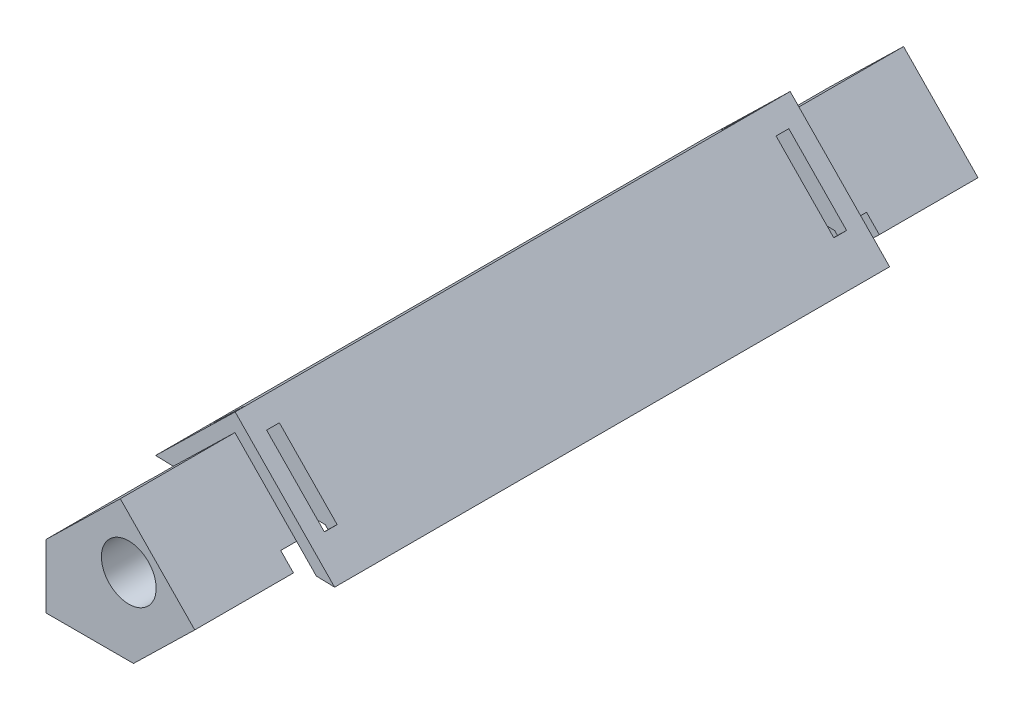
from build123d import *

# Parameters (mm, degrees)
BOSS_EXTRU_1_DEPTH       = 61.5
D_GAGEMENT_M41_D         = 4.3
D_GAGEMENT_M41_DEPTH     = 6
D_GAGEMENT_M41_TIP       = 1.291850331
D_GAGEMENT_M42_D         = 4.3
D_GAGEMENT_M42_DEPTH     = 6
D_GAGEMENT_M42_TIP       = 1.291850331
ESQUISSE9_W              = 1
ESQUISSE9_H              = 6.5
ENL_V_MAT_EXTRU_2_DEPTH  = 66.352343655
ESQUISSE11_W             = 3
ESQUISSE11_H             = 1
ENL_V_MAT_EXTRU_3_DEPTH  = 1
ENL_V_MAT_EXTRU_4_DEPTH  = 23
ENL_V_MAT_EXTRU_7_DEPTH  = 23
ESQUISSE16_W             = 8.145455673
ESQUISSE16_H             = 43.5
ESQUISSE16_W_2           = 3
ESQUISSE16_H_2           = 1
BOSS_EXTRU_2_DEPTH       = 1
ESQUISSE17_W             = 43.576204057
ESQUISSE17_H             = 9.375689411
ESQUISSE17_W_2           = 1
ESQUISSE17_H_2           = 6.5
BOSS_EXTRU_3_DEPTH       = 1
ESQUISSE18_W             = 16.892190225
ESQUISSE18_H             = 46
ENL_V_MAT_EXTRU_8_DEPTH  = 1
BOSS_EXTRU_4_START       = -43.576204
BOSS_EXTRU_4_DEPTH       = 43.576204
ESQUISSE23_W             = 1
ESQUISSE23_H             = 6.5
ENL_V_MAT_EXTRU_11_DEPTH = 66.811115965


with BuildPart() as part:
    # Esquisse1 → Boss.-Extru.1 (new body)
    with BuildSketch(Plane.XY):
        Polygon((-29.2538383, -8.878195219), (-29.2538383, -3.878764136), (-23.419589724, 1.805423729), (-17.574736592, -4.193731626), (-22.3828685, -8.878195219), align=None)
    extrude(amount=BOSS_EXTRU_1_DEPTH)

    # Dégagement M41
    with Locations(Plane.XY.offset(61.5)):
        with Locations((-22.7538383, -2.878195219)):
            Hole(D_GAGEMENT_M41_D / 2, depth=D_GAGEMENT_M41_DEPTH)
            with Locations((0, 0, -(D_GAGEMENT_M41_DEPTH + D_GAGEMENT_M41_TIP / 2))):  # 118° drill point
                Cone(0, D_GAGEMENT_M41_D / 2, D_GAGEMENT_M41_TIP, mode=Mode.SUBTRACT)

    # Dégagement M42
    with Locations(Plane(origin=(0, 0, 0), x_dir=(-1, 0, 0), z_dir=(0, 0, -1))):
        with Locations((22.7538383, -2.878195219)):
            Hole(D_GAGEMENT_M42_D / 2, depth=D_GAGEMENT_M42_DEPTH)
            with Locations((0, 0, -(D_GAGEMENT_M42_DEPTH + D_GAGEMENT_M42_TIP / 2))):  # 118° drill point
                Cone(0, D_GAGEMENT_M42_D / 2, D_GAGEMENT_M42_TIP, mode=Mode.SUBTRACT)

    # Esquisse9 → Enlèv. mat.-Extru.2 (cut, through all)
    with BuildSketch(Plane(origin=(-11.112445005, -10.826625609, 0), x_dir=(0, 0, -1), z_dir=(0.7162580965216612, 0.6978354671175484, 0))):
        with Locations((-50.75, 13.636169698)):
            Rectangle(ESQUISSE9_W, ESQUISSE9_H)
        with Locations((-10.75, 13.636169698)):
            Rectangle(ESQUISSE9_W, ESQUISSE9_H)
    extrude(amount=-ENL_V_MAT_EXTRU_2_DEPTH, mode=Mode.SUBTRACT)

    # Esquisse11 → Enlèv. mat.-Extru.3 (cut)
    with BuildSketch(Plane(origin=(-12.30714472, 12.632049338, 0), x_dir=(0.7162580965216613, 0.6978354671175482, 0), z_dir=(-0.6978354671175482, 0.7162580965216613, 0))):
        with Locations((-17.764582046, -50.75)):
            Rectangle(ESQUISSE11_W, ESQUISSE11_H)
        with Locations((-17.764582046, -10.75)):
            Rectangle(ESQUISSE11_W, ESQUISSE11_H)
    extrude(amount=-ENL_V_MAT_EXTRU_3_DEPTH, mode=Mode.SUBTRACT)

    # Esquisse14 → Enlèv. mat.-Extru.4 (cut)
    with BuildSketch(Plane(origin=(0, 0, 30.75), x_dir=(-1, 0, 0), z_dir=(0, 0, -1))):
        Polygon((22.3828685, -8.878195219), (29.2538383, -3.878764136), (29.2538383, -8.878195219), align=None)
    enl_v_mat_extru_4 = extrude(amount=-ENL_V_MAT_EXTRU_4_DEPTH, mode=Mode.SUBTRACT)

    # Esquisse15 → Enlèv. mat.-Extru.7 (cut)
    with BuildSketch(Plane(origin=(0, 0, 30.75), x_dir=(-1, 0, 0), z_dir=(0, 0, -1))):
        Polygon((17.574736592, -4.193731626), (22.3828685, -8.878195219), (29.2538383, -3.878764136), align=None)
    enl_v_mat_extru_7 = extrude(amount=-ENL_V_MAT_EXTRU_7_DEPTH, mode=Mode.SUBTRACT)

    # Symétrie2: Enlèv. mat.-Extru.4, Enlèv. mat.-Extru.7 across plane
    add(enl_v_mat_extru_4.mirror(Plane(origin=(0, 0, 30.75), x_dir=(1, 0, 0), z_dir=(0, 0, -1))), mode=Mode.SUBTRACT)
    add(enl_v_mat_extru_7.mirror(Plane(origin=(0, 0, 30.75), x_dir=(1, 0, 0), z_dir=(0, 0, -1))), mode=Mode.SUBTRACT)

    # Esquisse16 → Boss.-Extru.2 (add)
    with BuildSketch(Plane(origin=(-12.30714472, 12.632049338, 0), x_dir=(0.7162580965216613, 0.6978354671175481, 0), z_dir=(-0.6978354671175481, 0.7162580965216613, 0))):
        with Locations((-19.587309883, -30.75)):
            Rectangle(ESQUISSE16_W, ESQUISSE16_H)
        with Locations((-17.764582046, -10.75)):
            Rectangle(ESQUISSE16_W_2, ESQUISSE16_H_2, mode=Mode.SUBTRACT)
        with Locations((-17.764582046, -50.75)):
            Rectangle(ESQUISSE16_W_2, ESQUISSE16_H_2, mode=Mode.SUBTRACT)
    extrude(amount=BOSS_EXTRU_2_DEPTH)

    # Esquisse17 → Boss.-Extru.3 (add)
    with BuildSketch(Plane(origin=(-11.112445005, -10.826625609, 0), x_dir=(0, 0, -1), z_dir=(0.7162580965216608, 0.6978354671175485, 0))):
        with Locations((-30.711897972, 13.948324992)):
            Rectangle(ESQUISSE17_W, ESQUISSE17_H)
        with Locations((-50.75, 13.636169698)):
            Rectangle(ESQUISSE17_W_2, ESQUISSE17_H_2, mode=Mode.SUBTRACT)
        with Locations((-10.75, 13.636169698)):
            Rectangle(ESQUISSE17_W_2, ESQUISSE17_H_2, mode=Mode.SUBTRACT)
    extrude(amount=BOSS_EXTRU_3_DEPTH)

    # Esquisse18 → Enlèv. mat.-Extru.8 (cut)
    with BuildSketch(Plane(origin=(-0.12578911, -4.664303021, 0), x_dir=(-0.9996365490865532, 0.026958667072524062, 0), z_dir=(-0.026958667072524065, -0.9996365490865533, 0))):
        with Locations((22.669999121, -30.75)):
            Rectangle(ESQUISSE18_W, ESQUISSE18_H)
    extrude(amount=-ENL_V_MAT_EXTRU_8_DEPTH, mode=Mode.SUBTRACT)

    # Esquisse21 → Boss.-Extru.4 (add)
    with BuildSketch(Plane.XY.offset(52.5).offset(BOSS_EXTRU_4_START)):
        Polygon((-17.141851408, -3.205042293), (-15.591482071, -4.796340876), (-17.025300163, -4.757672998), (-18.575669499, -3.166374415), align=None)
    extrude(amount=BOSS_EXTRU_4_DEPTH)

    # Esquisse23 → Enlèv. mat.-Extru.11 (cut, through all)
    with BuildSketch(Plane(origin=(-10.396186908, -10.128790142, 0), x_dir=(0, 0, -1), z_dir=(0.7162580965216607, 0.6978354671175486, 0))):
        with Locations((-50.75, 13.636169698)):
            Rectangle(ESQUISSE23_W, ESQUISSE23_H)
        with Locations((-10.75, 13.636169698)):
            Rectangle(ESQUISSE23_W, ESQUISSE23_H)
    extrude(amount=-ENL_V_MAT_EXTRU_11_DEPTH, mode=Mode.SUBTRACT)


solid = part.part
